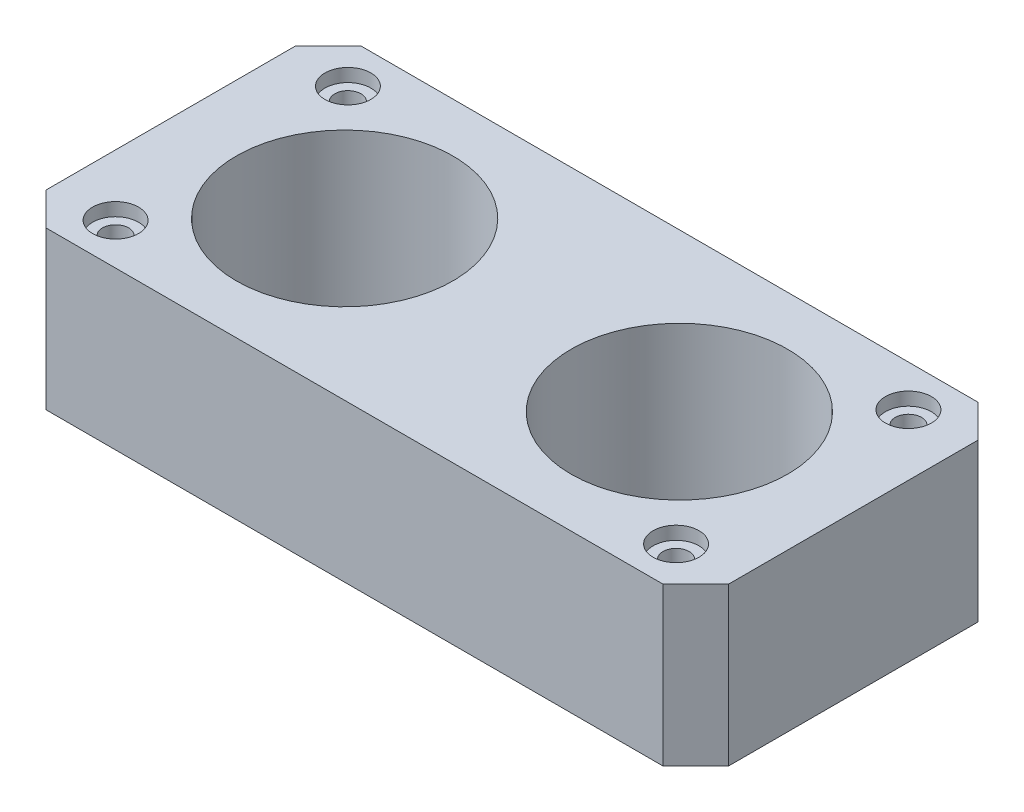
from build123d import *

# Parameters (mm, degrees)
SKETCH1_W           = 52
SKETCH1_H           = 24
SKETCH1_R           = 8.25
BOSS_EXTRUDE1_DEPTH = 12
SKETCH2_R           = 1
CUT_EXTRUDE1_DEPTH  = 32.048349393
SKETCH3_R           = 1.75
CUT_EXTRUDE2_DEPTH  = 1
CUT_EXTRUDE3_DEPTH  = 5
FILLET3_R           = 0.5
CHAMFER1_SIZE       = 2.5


with BuildPart() as part:
    # Sketch1 → Boss-Extrude1 (new body)
    with BuildSketch(Plane(origin=(0, 0, 0), x_dir=(1, 0, 0), z_dir=(0, 1, 0))):
        Rectangle(SKETCH1_W, SKETCH1_H)
        with Locations(Location((12.75, 0, 0), (0, 0, 270))):
            Circle(SKETCH1_R, mode=Mode.SUBTRACT)
        with Locations(Location((-12.75, 0, 0), (0, 0, 270))):
            Circle(SKETCH1_R, mode=Mode.SUBTRACT)
    extrude(amount=BOSS_EXTRUDE1_DEPTH)

    # Sketch2 → Cut-Extrude1 (cut, through all)
    with BuildSketch(Plane(origin=(0, 12, 0), x_dir=(1, 0, 0), z_dir=(0, 1, 0))):
        with Locations(Location((-21.35, 8.85, 0), (0, 0, 270))):
            Circle(SKETCH2_R)
        with Locations(Location((21.35, 8.85, 0), (0, 0, 270))):
            Circle(SKETCH2_R)
        with Locations(Location((21.35, -8.85, 0), (0, 0, 270))):
            Circle(SKETCH2_R)
        with Locations(Location((-21.35, -8.85, 0), (0, 0, 270))):
            Circle(SKETCH2_R)
    extrude(amount=-CUT_EXTRUDE1_DEPTH, mode=Mode.SUBTRACT)

    # Sketch3 → Cut-Extrude2 (cut)
    with BuildSketch(Plane(origin=(0, 12, 0), x_dir=(1, 0, 0), z_dir=(0, 1, 0))):
        with Locations(Location((-21.35, 8.85, 0), (0, 0, 270))):
            Circle(SKETCH3_R)
        with Locations(Location((21.35, 8.85, 0), (0, 0, 270))):
            Circle(SKETCH3_R)
        with Locations(Location((21.35, -8.85, 0), (0, 0, 270))):
            Circle(SKETCH3_R)
        with Locations(Location((-21.35, -8.85, 0), (0, 0, 270))):
            Circle(SKETCH3_R)
    extrude(amount=-CUT_EXTRUDE2_DEPTH, mode=Mode.SUBTRACT)

    # Sketch4 → Cut-Extrude3 (cut)
    with BuildSketch(Plane.XZ):
        Polygon((-6, -5), (-6, -12), (6, -12), (6, -5), (0, -5), align=None)
    extrude(amount=-CUT_EXTRUDE3_DEPTH, mode=Mode.SUBTRACT)

    # Fillet3
    fillet3_edges = [part.edges().sort_by_distance(p)[0] for p in [
        (-6, 2.5, -5),
        (6, 5, -8.5),
        (6, 2.5, -5),
        (-6, 5, -8.5),
        (0, 5, -5),
    ]]
    fillet(fillet3_edges, radius=FILLET3_R)

    # Chamfer1
    chamfer1_edges = [part.edges().sort_by_distance(p)[0] for p in [
        (26, 6, 12),
        (-26, 6, 12),
        (-26, 6, -12),
        (26, 6, -12),
    ]]
    chamfer(chamfer1_edges, length=CHAMFER1_SIZE)


solid = part.part
